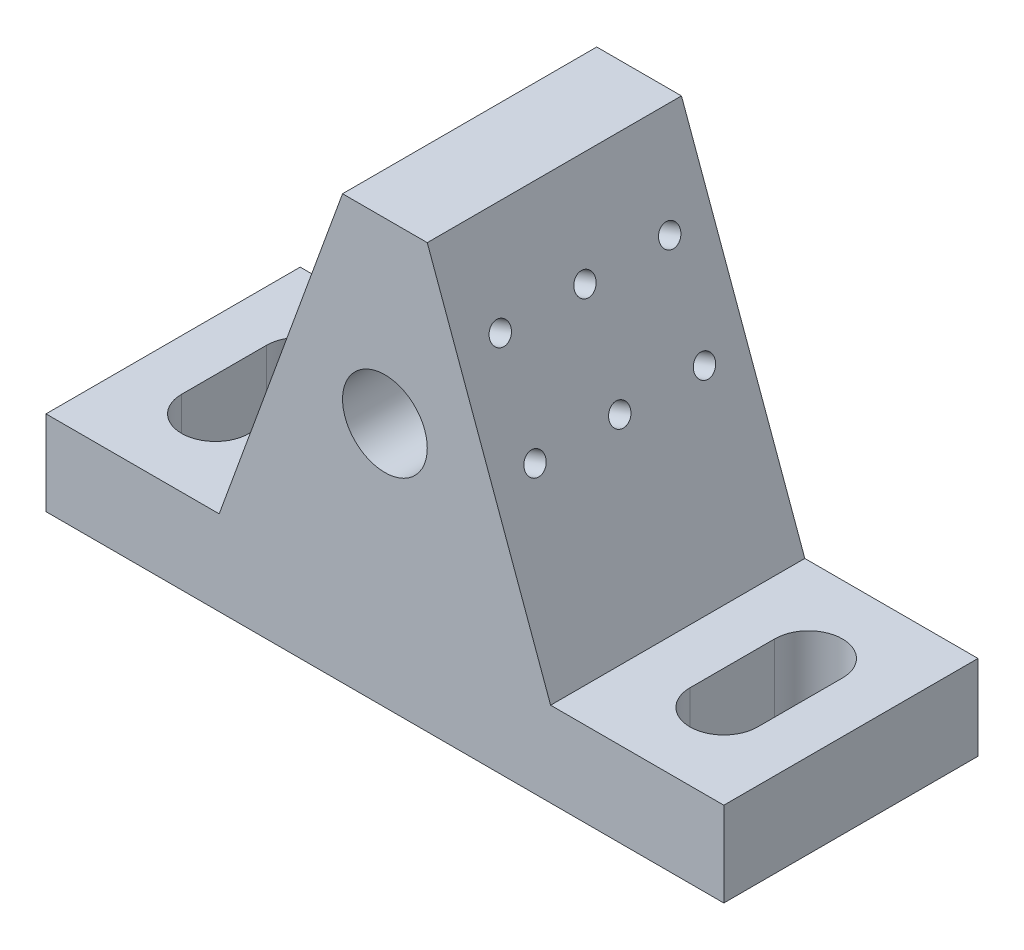
from build123d import *

# Parameters (mm, degrees)
BASE_EXTRUDE_DEPTH   = 15
SLOT_CUT_DEPTH       = 66.76473219
SKETCH5_R            = 5
GUIDE_HOLE_DEPTH     = 71.710678119
LPATTERN1_COUNT      = 3
LPATTERN1_PITCH      = 10
LPATTERN1_COUNT_DIR2 = 2
LPATTERN1_PITCH_DIR2 = 12


with BuildPart() as part:
    # Sketch2 → Base Extrude (new, symmetric)
    with BuildSketch(Plane.XY):
        Polygon((-40, 0), (40, 0), (40, 10), (19.558809371, 10), (5, 50), (-5, 50), (-19.558809371, 10), (-40, 10), align=None)
    extrude(amount=BASE_EXTRUDE_DEPTH, both=True)

    # Sketch4 → Slot Cut (cut, through all)
    with BuildSketch(Plane(origin=(0, 0, 0), x_dir=(1, 0, 0), z_dir=(0, 1, 0))):
        with BuildLine():
            Line((26, -5), (26, 5))
            ThreePointArc((26, 5), (30, 9), (34, 5))
            Line((34, 5), (34, -5))
            ThreePointArc((34, -5), (30, -9), (26, -5))
        make_face()
    slot_cut = extrude(amount=SLOT_CUT_DEPTH, mode=Mode.SUBTRACT)

    # Mirror1: Slot Cut across plane
    add(slot_cut.mirror(Plane(origin=(0, 0, 0), x_dir=(0, 0, 1), z_dir=(1, 0, 0))), mode=Mode.SUBTRACT)

    # Sketch5 → Guide Hole (cut, through all)
    with BuildSketch(Plane.XY.offset(15)):
        with Locations((0, 29)):
            Circle(SKETCH5_R)
    extrude(amount=-GUIDE_HOLE_DEPTH, mode=Mode.SUBTRACT)

    # Sketch10 → M3x0.5 Tapped Hole2 (revolve, cut)
    with BuildSketch(Plane(origin=(12.718406504, 28.793852416, 10), x_dir=(-0.3420201433256662, 0.9396926207859093, 0), z_dir=(0, 0, 1))):
        Polygon((0, 0), (0, 8.251075774), (1.25, 7.5), (1.25, 0), align=None)
    m3x0_5_tapped_hole2 = revolve(axis=Axis((18.685454646, 30.965680326, 10), (-0.9396926207859093, -0.34202014332566616, 0)), mode=Mode.SUBTRACT)

    # LPattern1: M3x0.5 Tapped Hole2 3 × 2
    with Locations(*[Vector(0, 0, -1) * (i * LPATTERN1_PITCH) + Vector(-0.34202014332566616, 0.9396926207859094, 0) * (j * LPATTERN1_PITCH_DIR2) for i in range(LPATTERN1_COUNT) for j in range(LPATTERN1_COUNT_DIR2) if (i, j) != (0, 0)]):
        add(m3x0_5_tapped_hole2, mode=Mode.SUBTRACT)


solid = part.part
